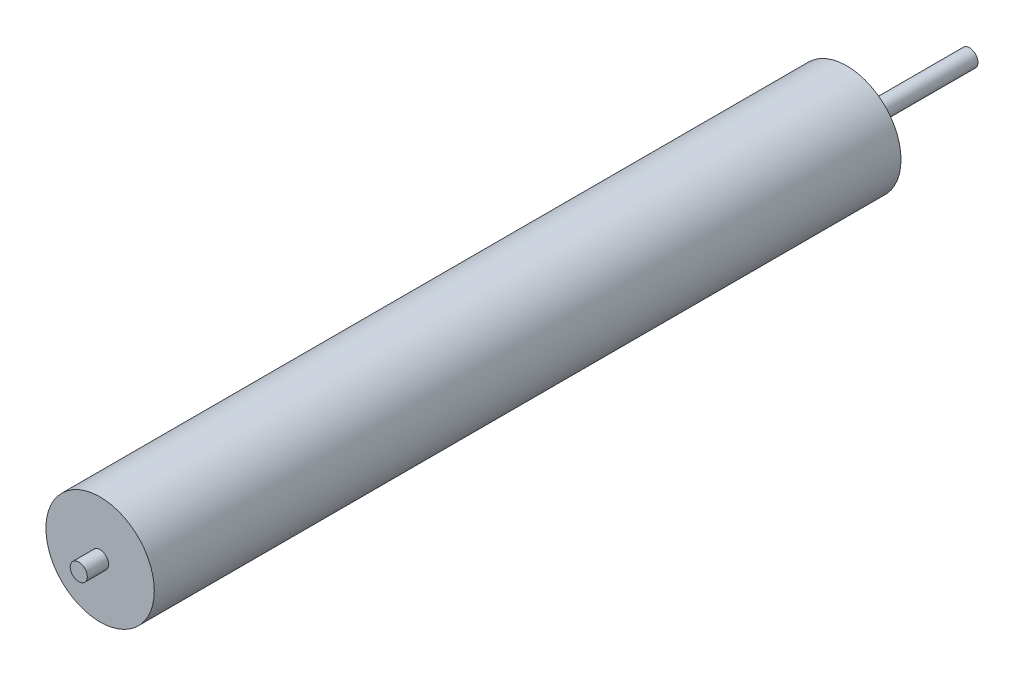
from build123d import *

# Parameters (mm, degrees)
SKETCH1_R           = 50.8
BOSS_EXTRUDE1_DEPTH = 350
SKETCH2_R           = 8
BOSS_EXTRUDE2_DEPTH = 370
SKETCH3_R           = 8
BOSS_EXTRUDE3_DEPTH = 95


with BuildPart() as part:
    # Sketch1 → Boss-Extrude1 (new, symmetric)
    with BuildSketch(Plane.XY):
        Circle(SKETCH1_R)
    extrude(amount=BOSS_EXTRUDE1_DEPTH, both=True)

    # Sketch2 → Boss-Extrude2 (add, symmetric)
    with BuildSketch(Plane.XY):
        Circle(SKETCH2_R)
    extrude(amount=BOSS_EXTRUDE2_DEPTH, both=True)

    # Sketch3 → Boss-Extrude3 (add)
    with BuildSketch(Plane(origin=(0, 0, -370), x_dir=(-1, 0, 0), z_dir=(0, 0, -1))):
        Circle(SKETCH3_R)
    extrude(amount=BOSS_EXTRUDE3_DEPTH)


solid = part.part
